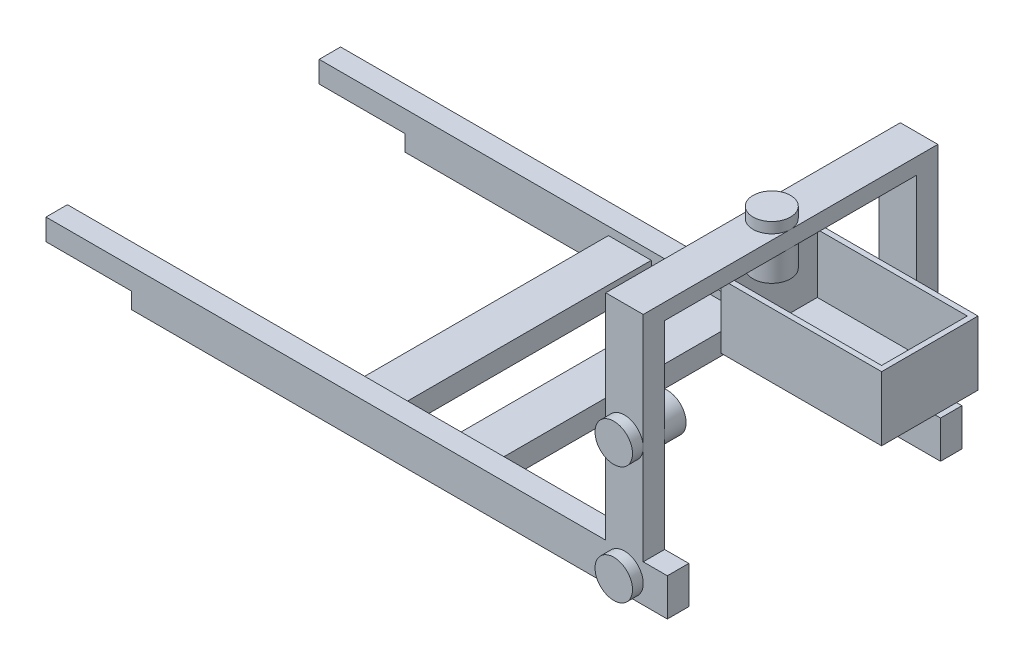
from build123d import *

# Parameters (mm, degrees)
BOSS_EXTRUDE1_DEPTH      = 50.8
BOSS_EXTRUDE2_DEPTH      = 50.8
SKETCH5_W                = 101.6
SKETCH5_H                = 50.8
BOSS_EXTRUDE3_DEPTH      = 596.9
SKETCH6_R                = 44.45
BOSS_EXTRUDE4_DEPTH      = 25.4
SKETCH7_W                = 88.9
SKETCH7_H                = 50.8
BOSS_EXTRUDE5_DEPTH      = 508
SKETCH8_W                = 88.9
SKETCH8_H                = 38.1
BOSS_EXTRUDE6_DEPTH      = 596.9
SKETCH10_W               = 381
SKETCH10_H               = 152.4
BOSS_EXTRUDE7_DEPTH      = 228.6
CUT_EXTRUDE1_DEPTH       = 139.7
BOSS_EXTRUDE8_DEPTH      = 25.4
BOSS_EXTRUDE8_DEPTH_BACK = 101.6
SKETCH13_R               = 44.45
BOSS_EXTRUDE9_DEPTH      = 25.4
BOSS_EXTRUDE9_DEPTH_BACK = 101.6
SKETCH14_R               = 44.45
BOSS_EXTRUDE10_START     = 25.4
SKETCH15_R               = 44.45
BOSS_EXTRUDE10_DEPTH     = 25.4


with BuildPart() as part:
    # Sketch1 → Boss-Extrude1 (new body)
    with BuildSketch(Plane.XY):
        Polygon((0, 0), (1473.2, 0), (1473.2, -88.9), (203.2, -88.9), (203.2, -50.8), (0, -50.8), align=None)
    extrude(amount=-BOSS_EXTRUDE1_DEPTH)



with BuildPart() as body_2:
    # Sketch4 → Boss-Extrude2 (new body)
    with BuildSketch(Plane.XY.offset(596.9)):
        Polygon((0, 0), (1473.2, 0), (1473.2, -88.9), (203.2, -88.9), (203.2, -50.8), (0, -50.8), align=None)
    extrude(amount=BOSS_EXTRUDE2_DEPTH)


with BuildPart() as part_1:
    add(part.part)

    add(body_2.part)  # Boss-Extrude3 merges body 2
    # Sketch5 → Boss-Extrude3 (add)
    with BuildSketch(Plane.XY):
        with Locations((965.2, -44.45)):
            Rectangle(SKETCH5_W, SKETCH5_H)
        with Locations((736.6, -44.45)):
            Rectangle(SKETCH5_W, SKETCH5_H)
    extrude(amount=BOSS_EXTRUDE3_DEPTH)

    # Sketch6 → Boss-Extrude4 (add)
    with BuildSketch(Plane.XY.offset(647.7)):
        with Locations(Location((1371.6, -44.45, 0), (0, 0, 270))):
            Circle(SKETCH6_R)
    extrude(amount=BOSS_EXTRUDE4_DEPTH)

    # Sketch7 → Boss-Extrude5 (add)
    with BuildSketch(Plane(origin=(0, 0, 0), x_dir=(1, 0, 0), z_dir=(0, 1, 0))):
        with Locations((1371.6, -622.3)):
            Rectangle(SKETCH7_W, SKETCH7_H)
        with Locations((1371.6, 25.4)):
            Rectangle(SKETCH7_W, SKETCH7_H)
    extrude(amount=BOSS_EXTRUDE5_DEPTH)

    # Sketch8 → Boss-Extrude6 (add)
    with BuildSketch(Plane.XY):
        with Locations((1371.6, 488.95)):
            Rectangle(SKETCH8_W, SKETCH8_H)
    extrude(amount=BOSS_EXTRUDE6_DEPTH)

    # Sketch10 → Boss-Extrude7 (add)
    with BuildSketch(Plane.XY):
        with Locations((1371.6, 177.8)):
            Rectangle(SKETCH10_W, SKETCH10_H)
    extrude(amount=BOSS_EXTRUDE7_DEPTH)

    # Sketch11 → Cut-Extrude1 (cut)
    with BuildSketch(Plane(origin=(0, 254, 0), x_dir=(1, 0, 0), z_dir=(0, 1, 0))):
        Polygon((1549.4, -12.7), (1416.05, -12.7), (1327.15, -12.7), (1193.8, -12.7), (1193.8, -215.9), (1549.4, -215.9), align=None)
    extrude(amount=-CUT_EXTRUDE1_DEPTH, mode=Mode.SUBTRACT)

    # Sketch13 → Boss-Extrude8 (add, two sides: drawn at the far end of the back side and taken through both)
    with BuildSketch(Plane(origin=(0, 508, 0), x_dir=(1, 0, 0), z_dir=(0, 1, 0)).offset(-BOSS_EXTRUDE8_DEPTH_BACK)):
        with Locations(Location((1371.6, -298.45, 0), (0, 0, 270))):
            Circle(SKETCH13_R)
    extrude(amount=BOSS_EXTRUDE8_DEPTH + BOSS_EXTRUDE8_DEPTH_BACK)

    # Sketch14 → Boss-Extrude9 (add, two sides: drawn at the far end of the back side and taken through both)
    with BuildSketch(Plane.XY.offset(647.7).offset(-BOSS_EXTRUDE9_DEPTH_BACK)):
        with Locations((1371.6, 234.95)):
            Circle(SKETCH14_R)
    extrude(amount=BOSS_EXTRUDE9_DEPTH + BOSS_EXTRUDE9_DEPTH_BACK)

    # Sketch15 → Boss-Extrude10 (add)
    with BuildSketch(Plane(origin=(0, 0, -50.8), x_dir=(-1, 0, 0), z_dir=(0, 0, -1)).offset(BOSS_EXTRUDE10_START)):
        with Locations(Location((-1371.6, -44.45, 0), (0, 0, 270))):
            Circle(SKETCH15_R)
    extrude(amount=-BOSS_EXTRUDE10_DEPTH)


solid = part_1.part
